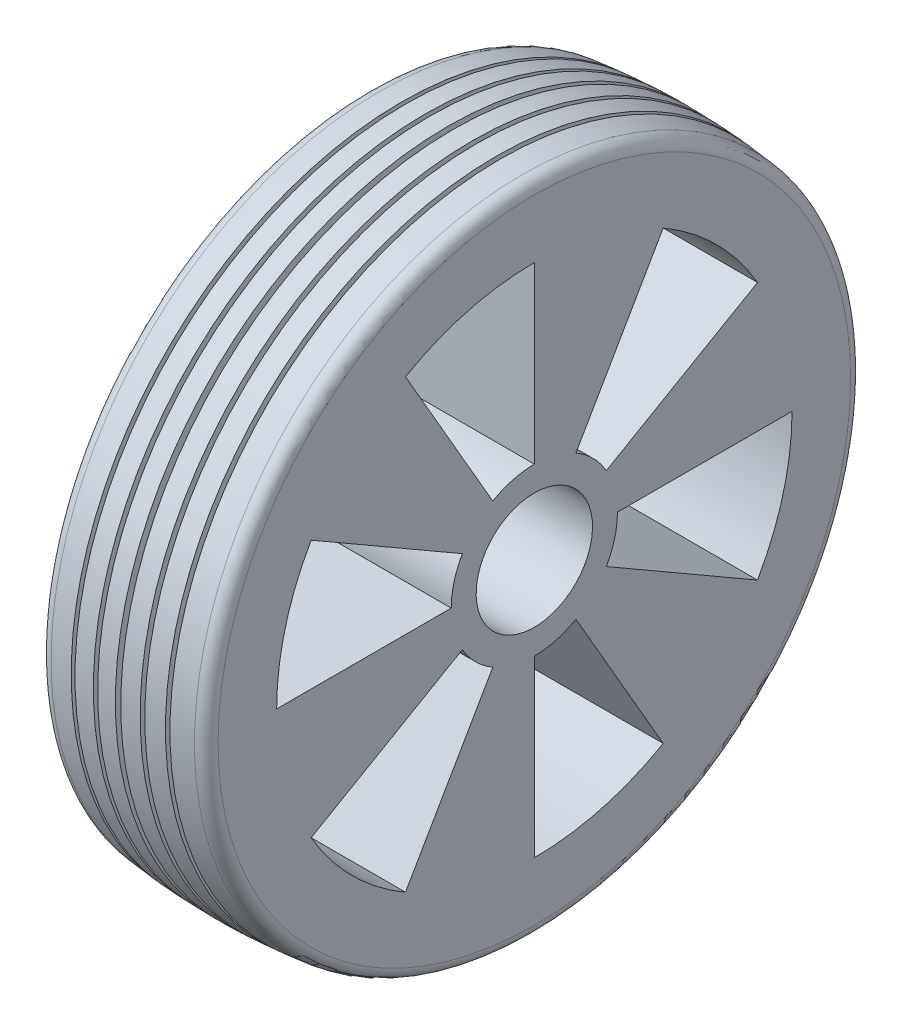
from build123d import *

# Parameters (mm, degrees)
CUT_EXTRUDE1_DEPTH = 208.14437265


with BuildPart() as part:
    # Sketch1 → Revolve2 (revolve)
    with BuildSketch(Plane.XY):
        with BuildLine():
            Line((-26.12818556, 25.011220729), (-26.12818556, 0))
            Line((-26.12818556, 0), (-26.12818556, -49.403))
            Line((-26.12818556, -49.403), (-26.12818556, -53.848))
            Line((-26.12818556, -53.848), (24.80932747, -53.848))
            Line((24.80932747, -53.848), (24.80932747, -49.403))
            Line((24.80932747, -49.403), (24.80932747, 0))
            Line((24.80932747, 0), (24.80932747, 25.011220729))
            ThreePointArc((24.80932747, 25.011220729), (23.754365298, 27.558124712), (21.207461315, 28.613086884))
            ThreePointArc((21.207461315, 28.613086884), (17.809651848, 28.995347699), (14.405209453, 29.31315971))
            Line((14.405209453, 29.31315971), (14.405209453, 27.343086884))
            Line((14.405209453, 27.343086884), (13.135209453, 27.343086884))
            Line((13.135209453, 27.343086884), (13.135209453, 29.41507638))
            ThreePointArc((13.135209453, 29.41507638), (10.154364595, 29.618891225), (7.170553789, 29.773324491))
            Line((7.170553789, 29.773324491), (7.170553789, 27.343086884))
            Line((7.170553789, 27.343086884), (5.805505117, 27.343086884))
            Line((5.805505117, 27.343086884), (5.805505117, 29.827472606))
            ThreePointArc((5.805505117, 29.827472606), (2.903214343, 29.908224778), (0, 29.942270642))
            Line((0, 29.942270642), (0, 27.343086884))
            Line((0, 27.343086884), (-0.684498309, 27.343086884))
            Line((-0.684498309, 27.343086884), (-1.644201764, 27.343086884))
            Line((-1.644201764, 27.343086884), (-1.644201764, 29.940832898))
            ThreePointArc((-1.644201764, 29.940832898), (-4.409791709, 29.904618084), (-7.174501735, 29.82601956))
            Line((-7.174501735, 29.82601956), (-7.174501735, 27.343086884))
            Line((-7.174501735, 27.343086884), (-8.539550408, 27.343086884))
            Line((-8.539550408, 27.343086884), (-8.539550408, 29.771565295))
            ThreePointArc((-8.539550408, 29.771565295), (-11.523366789, 29.616461362), (-14.504206072, 29.411975183))
            Line((-14.504206072, 29.411975183), (-14.504206072, 27.343086884))
            Line((-14.504206072, 27.343086884), (-15.774206072, 27.343086884))
            Line((-15.774206072, 27.343086884), (-15.774206072, 29.309771598))
            ThreePointArc((-15.774206072, 29.309771598), (-19.202900235, 28.988684715), (-22.624842728, 28.6022264))
            ThreePointArc((-22.624842728, 28.6022264), (-25.107272878, 27.519643178), (-26.12818556, 25.011220729))
        make_face()
    revolve(axis=Axis((24.80932747, -71.628, 0), (-1, 0, 0)))

    # Sketch2 → Cut-Extrude1 (cut, through all)
    with BuildSketch(Plane(origin=(24.80932747, 0, 0), x_dir=(0, 0, -1), z_dir=(1, 0, 0))):
        with BuildLine():
            ThreePointArc((-25.4, -71.628), (-24.534515988, -65.053996254), (-21.997045256, -58.928))
            Line((-21.997045256, -58.928), (-68.190840294, -32.258))
            ThreePointArc((-68.190840294, -32.258), (-76.056999562, -51.248588389), (-78.74, -71.628))
            Line((-78.74, -71.628), (-25.4, -71.628))
        make_face()
        with BuildLine():
            ThreePointArc((-12.7, -49.630954744), (-6.574003746, -47.093484012), (0, -46.228))
            Line((0, -46.228), (0, 7.112))
            ThreePointArc((0, 7.112), (-20.379411611, 4.428999562), (-39.37, -3.437159706))
            Line((-39.37, -3.437159706), (-12.7, -49.630954744))
        make_face()
        with BuildLine():
            Line((39.37, -3.437159706), (12.7, -49.630954744))
            ThreePointArc((12.7, -49.630954744), (17.960512242, -53.667487758), (21.997045256, -58.928))
            Line((21.997045256, -58.928), (68.190840294, -32.258))
            ThreePointArc((68.190840294, -32.258), (55.677587951, -15.950412049), (39.37, -3.437159706))
        make_face()
        with BuildLine():
            Line((78.74, -71.628), (25.4, -71.628))
            ThreePointArc((25.4, -71.628), (24.534515988, -78.202003746), (21.997045256, -84.328))
            Line((21.997045256, -84.328), (68.190840294, -110.998))
            ThreePointArc((68.190840294, -110.998), (76.056999562, -92.007411611), (78.74, -71.628))
        make_face()
        with BuildLine():
            Line((39.37, -139.818840294), (12.7, -93.625045256))
            ThreePointArc((12.7, -93.625045256), (6.574003746, -96.162515988), (0, -97.028))
            Line((0, -97.028), (0, -150.368))
            ThreePointArc((0, -150.368), (20.379411611, -147.684999562), (39.37, -139.818840294))
        make_face()
        with BuildLine():
            ThreePointArc((-12.7, -93.625045256), (-17.960512242, -89.588512242), (-21.997045256, -84.328))
            Line((-21.997045256, -84.328), (-68.190840294, -110.998))
            ThreePointArc((-68.190840294, -110.998), (-55.677587951, -127.305587951), (-39.37, -139.818840294))
            Line((-39.37, -139.818840294), (-12.7, -93.625045256))
        make_face()
    extrude(amount=-CUT_EXTRUDE1_DEPTH, mode=Mode.SUBTRACT)


solid = part.part
